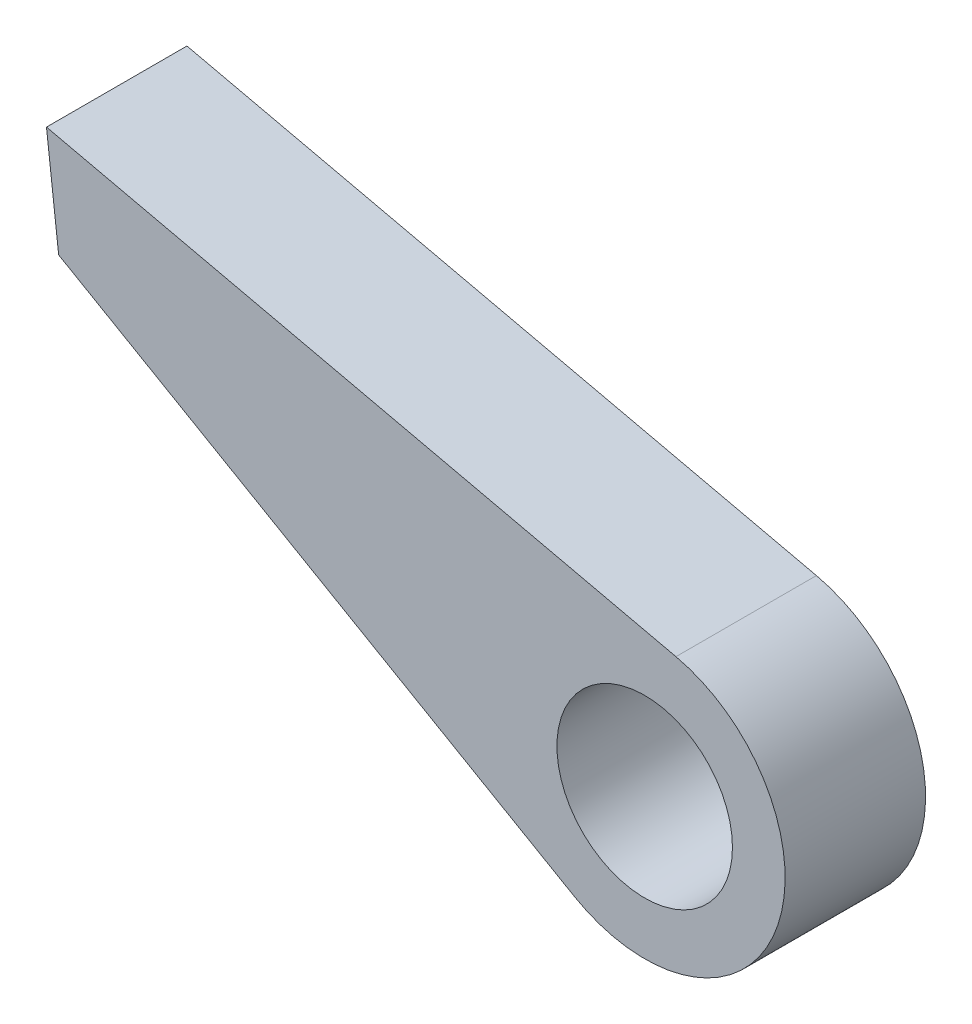
from build123d import *

# Parameters (mm, degrees)
SKETCH_1_R      = 1.25
EXTRUDE_1_DEPTH = 2


with BuildPart() as part:
    # 草图1 → 凸台-拉伸1 (new body)
    with BuildSketch(Plane.XY):
        with BuildLine():
            Line((-1, -1.732050808), (-8.345276688, 2.508746666))
            Line((-8.345276688, 2.508746666), (-8.518382461, 3.998724649))
            Line((-8.518382461, 3.998724649), (0.445667384, 1.949712949))
            ThreePointArc((0.445667384, 1.949712949), (1.861630267, -0.730980676), (-1, -1.732050808))
        make_face()
        Circle(SKETCH_1_R, mode=Mode.SUBTRACT)
    extrude(amount=EXTRUDE_1_DEPTH)


solid = part.part
